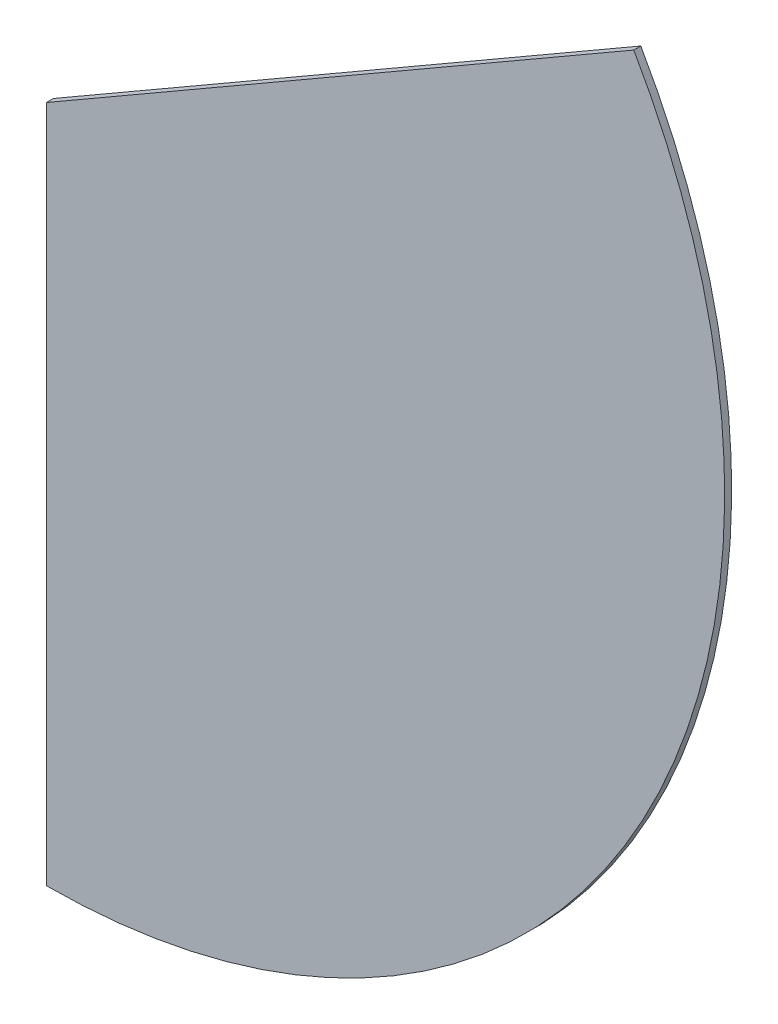
from build123d import *

# Parameters (mm, degrees)
EXTRUDE_1_DEPTH = 1.6


with BuildPart() as part:
    # 草圖1 → 填料-伸長1 (new body)
    with BuildSketch(Plane.XY):
        with BuildLine():
            Line((0, 0), (0, -155))
            ThreePointArc((0, -155), (134.233937587, -77.5), (134.233937587, 77.5))
            Line((134.233937587, 77.5), (0, 0))
        make_face()
    extrude(amount=EXTRUDE_1_DEPTH)


solid = part.part
